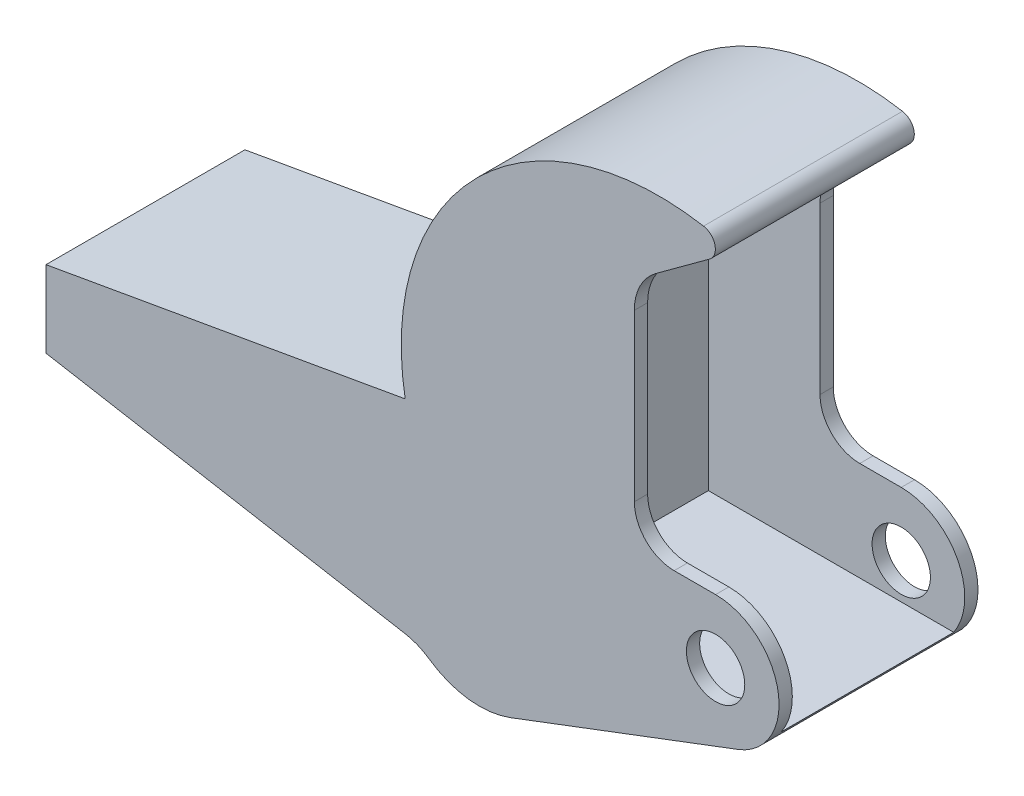
from build123d import *

# Parameters (mm, degrees)
BOSS_EXTRUDE1_DEPTH = 30
SKETCH2_R           = 4.4
CUT_EXTRUDE1_DEPTH  = 97.608495293
SKETCH4_W           = 26
SKETCH4_H           = 53.255509589
CUT_EXTRUDE2_DEPTH  = 40


with BuildPart() as part:
    # Sketch1 → Boss-Extrude1 (new body)
    with BuildSketch(Plane.XY):
        with BuildLine():
            Line((-41.88810428, 5.785), (12.276322135, 15.335649772))
            ThreePointArc((12.276322135, 15.335649772), (23.057327156, 49.569411506), (57.276322135, 60.397194952))
            ThreePointArc((57.276322135, 60.397194952), (59.00041024, 58.767721176), (58.177057872, 56.542916587))
            Line((58.177057872, 56.542916587), (50.110478485, 50.632730719))
            ThreePointArc((50.110478485, 50.632730719), (47.703320965, 47.797119103), (46.838627179, 44.179467209))
            Line((46.838627179, 44.179467209), (46.838627179, 19.179467209))
            ThreePointArc((46.838627179, 19.179467209), (48.595986492, 14.936826522), (52.838627179, 13.179467209))
            Line((52.838627179, 13.179467209), (59.088627179, 13.179467209))
            ThreePointArc((59.088627179, 13.179467209), (68.507642402, 5.328734817), (62.482043199, -5.350403777))
            Line((62.482043199, -5.350403777), (28.173137316, -18.352594225))
            ThreePointArc((28.173137316, -18.352594225), (21.856973189, -19.111848957), (15.915778413, -16.837513523))
            ThreePointArc((15.915778413, -16.837513523), (14.177787103, -15.888509343), (12.276322135, -15.335649772))
            Line((12.276322135, -15.335649772), (-41.88810428, -5.785))
            Line((-41.88810428, -5.785), (-41.88810428, 5.785))
        make_face()
    extrude(amount=BOSS_EXTRUDE1_DEPTH)

    # Sketch2 → Cut-Extrude1 (cut, through all)
    with BuildSketch(Plane.XY.offset(30)):
        with Locations((59.088627179, 3.603809847)):
            Circle(SKETCH2_R)
    extrude(amount=-CUT_EXTRUDE1_DEPTH, mode=Mode.SUBTRACT)

    # Sketch4 → Cut-Extrude2 (cut)
    with BuildSketch(Plane(origin=(70, 0, 0), x_dir=(0, 0, -1), z_dir=(1, 0, 0))):
        with Locations((-15, 24.841006249)):
            Rectangle(SKETCH4_W, SKETCH4_H)
    extrude(amount=-CUT_EXTRUDE2_DEPTH, mode=Mode.SUBTRACT)


solid = part.part
